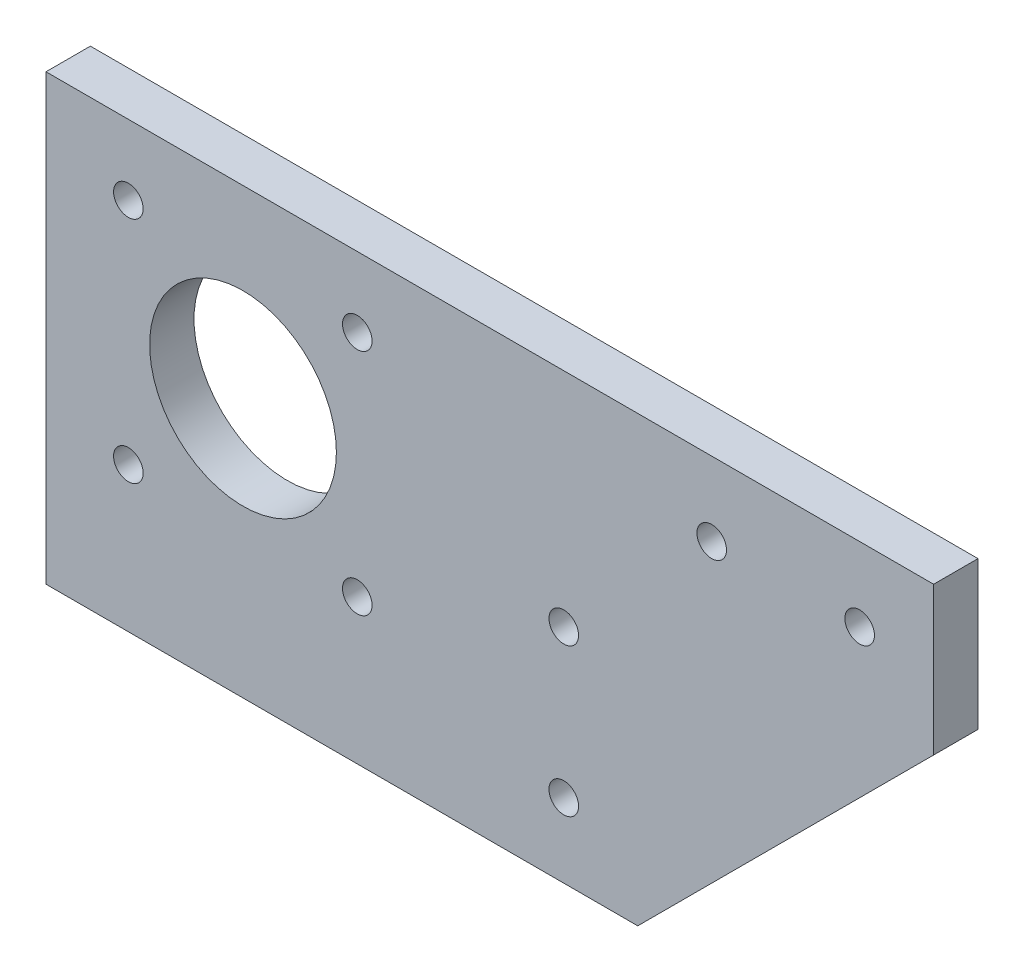
from build123d import *

# Parameters (mm, degrees)
SKETCH1_R           = 2
SKETCH1_R_2         = 12.625986588
BOSS_EXTRUDE1_DEPTH = 6
SKETCH2_R           = 2
CUT_EXTRUDE1_DEPTH  = 10


with BuildPart() as part:
    # Sketch1 → Boss-Extrude1 (new body)
    with BuildSketch(Plane.XY):
        Polygon((20, -60), (60, -20), (60, 0), (0, 0), (-60, 0), (-60, -60), (0, -60), align=None)
        with Locations((50, -10)):
            Circle(SKETCH1_R, mode=Mode.SUBTRACT)
        with Locations((30, -10)):
            Circle(SKETCH1_R, mode=Mode.SUBTRACT)
        with Locations((10, -50)):
            Circle(SKETCH1_R, mode=Mode.SUBTRACT)
        with Locations((10, -30)):
            Circle(SKETCH1_R, mode=Mode.SUBTRACT)
        with Locations((-33.365647648, -24.93)):
            Circle(SKETCH1_R_2, mode=Mode.SUBTRACT)
    extrude(amount=BOSS_EXTRUDE1_DEPTH)

    # Sketch2 → Cut-Extrude1 (cut)
    with BuildSketch(Plane(origin=(0, 0, 0), x_dir=(-1, 0, 0), z_dir=(0, 0, -1))):
        with Locations((17.915647648, -9.48)):
            Circle(SKETCH2_R)
        with Locations((17.915647648, -40.43)):
            Circle(SKETCH2_R)
        with Locations((48.865647648, -9.48)):
            Circle(SKETCH2_R)
        with Locations((48.865647648, -40.43)):
            Circle(SKETCH2_R)
    extrude(amount=-CUT_EXTRUDE1_DEPTH, mode=Mode.SUBTRACT)


solid = part.part
